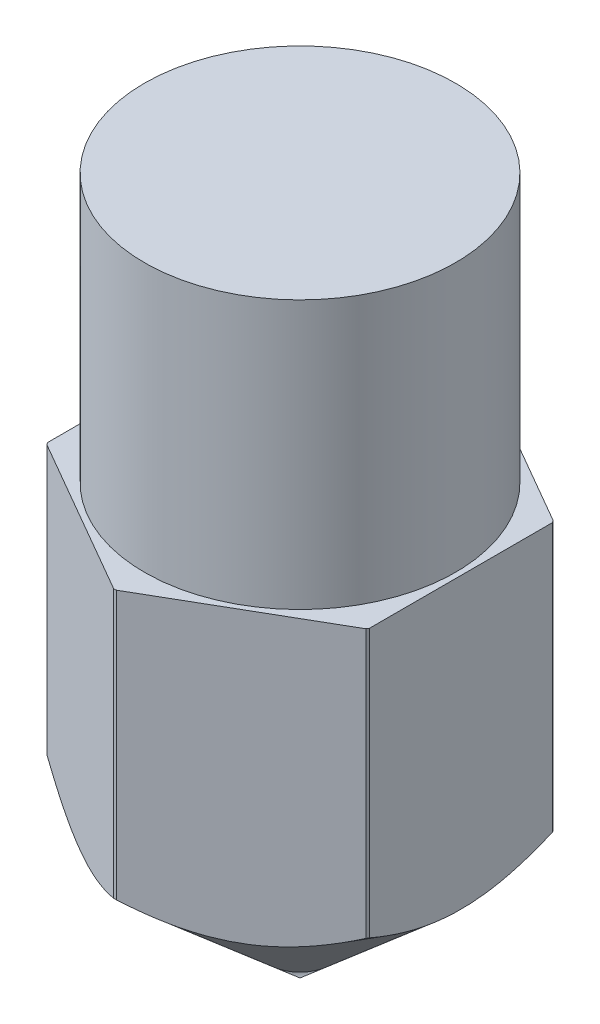
from build123d import *

# Parameters (mm, degrees)
SKETCH2_OUTSIDE_W  = 12.15
SKETCH2_OUTSIDE_H  = 12.15
CUT_EXTRUDE1_DEPTH = 20


with BuildPart() as part:
    # Sketch1 → Revolve1 (revolve)
    with BuildSketch(Plane.XY):
        Polygon((-2.9, 0), (0, 0), (0, -13), (-3.45, -10), (-3.45, -5), (-2.9, -5), align=None)
    revolve(axis=Axis((0, 0, 0), (0, -1, 0)))

    # Sketch2 outside → Cut-Extrude1 (cut)
    with BuildSketch(Plane(origin=(0, 0, 0), x_dir=(1, 0, 0), z_dir=(0, 1, 0))):
        Rectangle(SKETCH2_OUTSIDE_W, SKETCH2_OUTSIDE_H)
        Polygon((0, 3.464101615), (-3, 1.732050808), (-3, -1.732050808), (0, -3.464101615), (3, -1.732050808), (3, 1.732050808), align=None, mode=Mode.SUBTRACT)
    extrude(amount=-CUT_EXTRUDE1_DEPTH, mode=Mode.SUBTRACT)


solid = part.part
